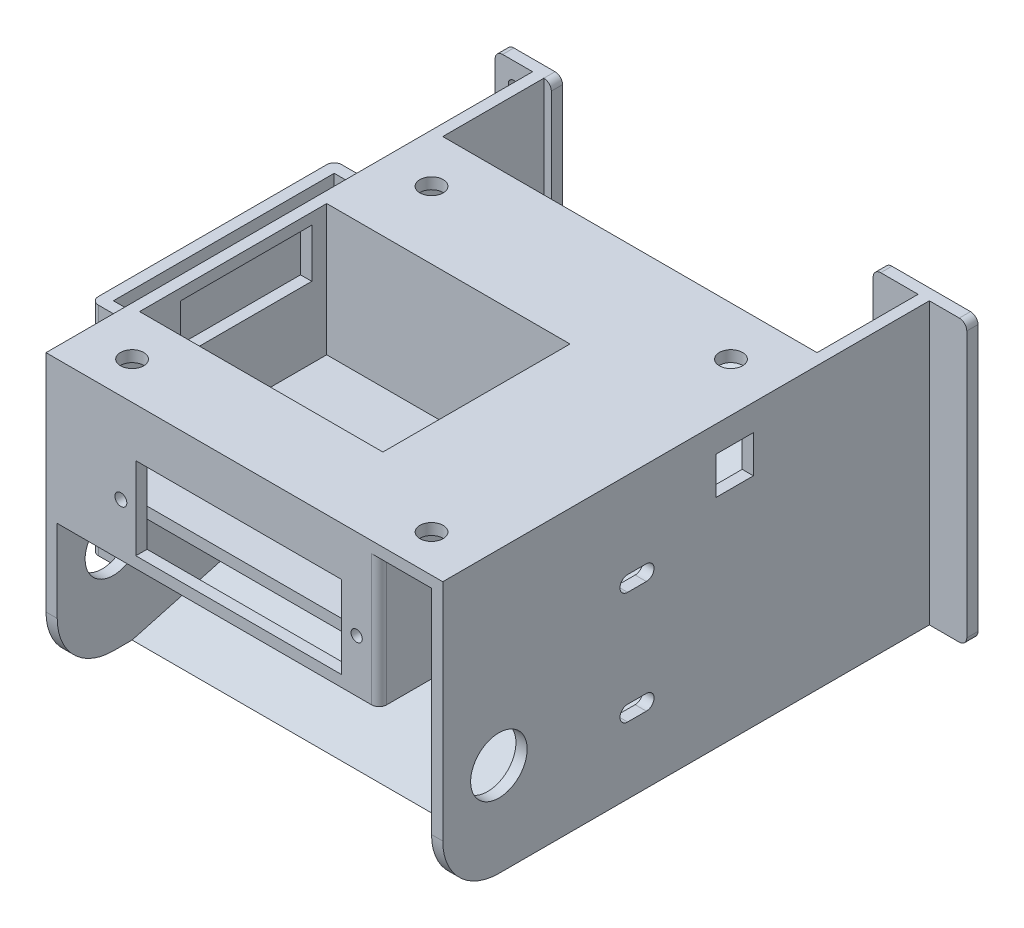
from build123d import *

# Parameters (mm, degrees)
SKETCH_1_W                      = 126
SKETCH_1_H                      = 75
EXTRUDE_1_DEPTH                 = 3
CUT_EXTRUDE_2_REACH             = 148.663
SKETCH_3_W                      = 86
SKETCH_3_H                      = 50
SKETCH_2_R                      = 1.5
CUT_EXTRUDE_1_DEPTH             = 147.662878739
SKETCH_4_W                      = 3
SKETCH_4_H                      = 75
EXTRUDE_2_DEPTH                 = 130
SKETCH_10_W                     = 100
SKETCH_10_H                     = 3
EXTRUDE_5_DEPTH                 = 100
CUT_EXTRUDE_5_REACH             = 199.965
SKETCH_9_R                      = 3.1
CUT_EXTRUDE_5_DIRECTION_2_DEPTH = 198.964643308
EXTRUDE_7_REACH                 = 191.955
CUT_EXTRUDE_9_DEPTH             = 190.95525789
CUT_EXTRUDE_9_DEPTH_BACK        = 190.95525789
SKETCH_18_R                     = 7.55
SKETCH_33_W                     = 65
SKETCH_33_H                     = 50
CUT_EXTRUDE_14_DEPTH            = 5
FILLET_1_R                      = 2
FILLET_2_R                      = 15
CUT_EXTRUDE_11_DEPTH            = 10
SKETCH_37_W                     = 89
SKETCH_37_H                     = 75
SKETCH_37_W_2                   = 83
SKETCH_37_H_2                   = 69
EXTRUDE_21_DEPTH                = 35
EXTRUDE_22_REACH                = 191.955
SKETCH_38_W                     = 59
SKETCH_38_H                     = 3
EXTRUDE_START                   = 5
EXTRUDE_23_DEPTH                = 75
SKETCH_43_W                     = 65
SKETCH_43_H                     = 58
EXTRUDE_24_DEPTH                = 23
SKETCH_44_W                     = 20
SKETCH_44_H                     = 59
CUT_EXTRUDE_15_DEPTH            = 55
SKETCH_48_W                     = 35
SKETCH_48_H                     = 13
CUT_EXTRUDE_16_DEPTH            = 12
SKETCH_49_W                     = 55
SKETCH_49_H                     = 22
CUT_EXTRUDE_18_DEPTH            = 12
SKETCH_50_R                     = 1.6
SKETCH_50_R_2                   = 1.5
CUT_EXTRUDE_19_DEPTH            = 12
CUT_EXTRUDE_21_REACH            = 201.887
SKETCH_52_W                     = 10
SKETCH_52_H                     = 10
FILLET_3_R                      = 2
SKETCH_53_W                     = 100
SKETCH_53_H                     = 3
EXTRUDE_25_DEPTH                = 3


with BuildPart() as part:
    # 草图1 → 凸台-拉伸1 (new body)
    with BuildSketch(Plane.XY):
        with Locations((63, 37.5)):
            Rectangle(SKETCH_1_W, SKETCH_1_H)
    extrude(amount=EXTRUDE_1_DEPTH)

    # 草图3 → 切除-拉伸2 (cut, up to next)
    with BuildSketch(Plane(origin=(0, 0, 0), x_dir=(-1, 0, 0), z_dir=(0, 0, -1)), mode=Mode.PRIVATE) as cut_extrude_2_sk1:
        with Locations((-58, 50)):
            Rectangle(SKETCH_3_W, SKETCH_3_H)
    cut_extrude_2_tool1 = extrude(cut_extrude_2_sk1.sketch, amount=-CUT_EXTRUDE_2_REACH, mode=Mode.PRIVATE) & part.part
    add(cut_extrude_2_tool1.solids().sort_by_distance((58, 50, 0))[0], mode=Mode.SUBTRACT)

    # 草图2 → 切除-拉伸1 (cut, through all)
    with BuildSketch(Plane.XY.offset(3)):
        with Locations((5, 69)):
            Circle(SKETCH_2_R)
        with Locations((5, 25)):
            Circle(SKETCH_2_R)
        with Locations((5, 9)):
            Circle(SKETCH_2_R)
        with Locations((111, 69)):
            Circle(SKETCH_2_R)
        with Locations((111, 9)):
            Circle(SKETCH_2_R)
    extrude(amount=-CUT_EXTRUDE_1_DEPTH, mode=Mode.SUBTRACT)

    # 草图4 → 凸台-拉伸2 (add)
    with BuildSketch(Plane.XY.offset(3)):
        with Locations((11.5, 37.5)):
            Rectangle(SKETCH_4_W, SKETCH_4_H)
    extrude_2 = extrude(amount=EXTRUDE_2_DEPTH)

    # 镜向1: 凸台-拉伸2 across plane
    add(extrude_2.mirror(Plane.ZY.offset(-63)))

    # 草图10 → 凸台-拉伸5 (add)
    with BuildSketch(Plane(origin=(13, 0, 0), x_dir=(0, 0, -1), z_dir=(1, 0, 0))):
        with Locations((-83, 73.5)):
            Rectangle(SKETCH_10_W, SKETCH_10_H)
    extrude(amount=EXTRUDE_5_DEPTH)

    # 草图9 → 切除-拉伸5 (cut, up to next)
    with BuildSketch(Plane(origin=(0, 75, 0), x_dir=(1, 0, 0), z_dir=(0, 1, 0)), mode=Mode.PRIVATE) as cut_extrude_5_sk1:
        with Locations(Location((23, -123, 0), (0, 0, 180))):
            Circle(SKETCH_9_R)
    cut_extrude_5_tool1 = extrude(cut_extrude_5_sk1.sketch, amount=-CUT_EXTRUDE_5_REACH, mode=Mode.PRIVATE) & part.part
    # 草图9 → 切除-拉伸5 (cut, up to next)
    with BuildSketch(Plane(origin=(0, 75, 0), x_dir=(1, 0, 0), z_dir=(0, 1, 0)), mode=Mode.PRIVATE) as cut_extrude_5_sk2:
        with Locations(Location((23, -43, 0), (0, 0, 180))):
            Circle(SKETCH_9_R)
    cut_extrude_5_tool2 = extrude(cut_extrude_5_sk2.sketch, amount=-CUT_EXTRUDE_5_REACH, mode=Mode.PRIVATE) & part.part
    # 草图9 → 切除-拉伸5 (cut, up to next)
    with BuildSketch(Plane(origin=(0, 75, 0), x_dir=(1, 0, 0), z_dir=(0, 1, 0)), mode=Mode.PRIVATE) as cut_extrude_5_sk3:
        with Locations(Location((103, -123, 0), (0, 0, 180))):
            Circle(SKETCH_9_R)
    cut_extrude_5_tool3 = extrude(cut_extrude_5_sk3.sketch, amount=-CUT_EXTRUDE_5_REACH, mode=Mode.PRIVATE) & part.part
    # 草图9 → 切除-拉伸5 (cut, up to next)
    with BuildSketch(Plane(origin=(0, 75, 0), x_dir=(1, 0, 0), z_dir=(0, 1, 0)), mode=Mode.PRIVATE) as cut_extrude_5_sk4:
        with Locations(Location((103, -43, 0), (0, 0, 180))):
            Circle(SKETCH_9_R)
    cut_extrude_5_tool4 = extrude(cut_extrude_5_sk4.sketch, amount=-CUT_EXTRUDE_5_REACH, mode=Mode.PRIVATE) & part.part
    add(cut_extrude_5_tool1.solids().sort_by_distance((23, 75, 123))[0], mode=Mode.SUBTRACT)
    add(cut_extrude_5_tool2.solids().sort_by_distance((23, 75, 43))[0], mode=Mode.SUBTRACT)
    add(cut_extrude_5_tool3.solids().sort_by_distance((103, 75, 123))[0], mode=Mode.SUBTRACT)
    add(cut_extrude_5_tool4.solids().sort_by_distance((103, 75, 43))[0], mode=Mode.SUBTRACT)

    # 草图9 → 切除-拉伸5 direction 2 (cut)
    with BuildSketch(Plane(origin=(0, 75, 0), x_dir=(1, 0, 0), z_dir=(0, 1, 0))):
        with Locations(Location((23, -123, 0), (0, 0, 180))):
            Circle(SKETCH_9_R)
        with Locations(Location((23, -43, 0), (0, 0, 180))):
            Circle(SKETCH_9_R)
        with Locations(Location((103, -123, 0), (0, 0, 180))):
            Circle(SKETCH_9_R)
        with Locations(Location((103, -43, 0), (0, 0, 180))):
            Circle(SKETCH_9_R)
    extrude(amount=CUT_EXTRUDE_5_DIRECTION_2_DEPTH, mode=Mode.SUBTRACT)

    # 凸台-拉伸7: up to this face of the body (flat: up to its plane)
    extrude_7_end = Plane(part.part.faces().sort_by_distance((113, 36.357142857, 67.523809524))[0])
    # 草图17 → 凸台-拉伸7 (add, up to the picked face)
    with BuildSketch(Plane(origin=(13, 0, 0), x_dir=(0, 0, -1), z_dir=(1, 0, 0)), mode=Mode.PRIVATE) as extrude_7_sk1:
        Polygon((-3, 0), (-113, 0), (-3, 30), align=None)
    extrude_7_tool1 = split(extrude(extrude_7_sk1.sketch, amount=EXTRUDE_7_REACH, mode=Mode.PRIVATE), bisect_by=extrude_7_end, keep=Keep.BOTH, mode=Mode.PRIVATE)
    add(extrude_7_tool1.solids().sort_by(Axis((13, 10, 39.666667), (1, 0, 0)))[0])

    # 草图18 → 切除-拉伸9 (cut, two sides: drawn at the far end of the back side and taken through both)
    with BuildSketch(Plane(origin=(13, 0, 0), x_dir=(0, 0, -1), z_dir=(1, 0, 0)).offset(-CUT_EXTRUDE_9_DEPTH_BACK)):
        with Locations(Location((-118, 25, 0), (0, 0, 90))):
            Circle(SKETCH_18_R)
    extrude(amount=CUT_EXTRUDE_9_DEPTH + CUT_EXTRUDE_9_DEPTH_BACK, mode=Mode.SUBTRACT)

    # 草图33 → 切除-拉伸14 (cut)
    with BuildSketch(Plane(origin=(0, 75, 0), x_dir=(1, 0, 0), z_dir=(0, 1, 0))):
        with Locations((45.5, -86)):
            Rectangle(SKETCH_33_W, SKETCH_33_H)
    extrude(amount=-CUT_EXTRUDE_14_DEPTH, mode=Mode.SUBTRACT)

    # 圆角1
    fillet_1_edges = [part.edges().sort_by_distance(p)[0] for p in [
        (101, 75, 1.5),
        (15, 75, 1.5),
        (0, 0, 1.5),
        (0, 75, 1.5),
        (126, 75, 1.5),
        (126, 0, 1.5),
    ]]
    fillet(fillet_1_edges, radius=FILLET_1_R)

    # 圆角2
    fillet_2_edges = [part.edges().sort_by_distance(p)[0] for p in [
        (11.5, 0, 133),
        (114.5, 0, 133),
    ]]
    fillet(fillet_2_edges, radius=FILLET_2_R)

    # 草图20 → 切除-拉伸11 (cut)
    with BuildSketch(Plane(origin=(116, 0, 0), x_dir=(0, 0, -1), z_dir=(1, 0, 0))):
        with BuildLine():
            Line((-83.606081957, 51.95), (-78.606081957, 51.95))
            ThreePointArc((-78.606081957, 51.95), (-76.556081957, 49.9), (-78.606081957, 47.85))
            Line((-78.606081957, 47.85), (-83.606081957, 47.85))
            ThreePointArc((-83.606081957, 47.85), (-85.656081957, 49.9), (-83.606081957, 51.95))
        make_face()
        with BuildLine():
            Line((-83.606081957, 21.95), (-78.606081957, 21.95))
            ThreePointArc((-78.606081957, 21.95), (-76.556081957, 19.9), (-78.606081957, 17.85))
            Line((-78.606081957, 17.85), (-83.606081957, 17.85))
            ThreePointArc((-83.606081957, 17.85), (-85.656081957, 19.9), (-83.606081957, 21.95))
        make_face()
    extrude(amount=-CUT_EXTRUDE_11_DEPTH, mode=Mode.SUBTRACT)

    # 草图37 → 凸台-拉伸21 (add)
    with BuildSketch(Plane.XZ.offset(-72)):
        with Locations((54.5, 95.5)):
            Rectangle(SKETCH_37_W, SKETCH_37_H)
        with Locations((54.5, 95.5)):
            Rectangle(SKETCH_37_W_2, SKETCH_37_H_2, mode=Mode.SUBTRACT)
    extrude(amount=EXTRUDE_21_DEPTH)

    # 草图38 → 凸台-拉伸22 (add, up to next)
    with BuildSketch(Plane(origin=(13, 0, 0), x_dir=(0, 0, -1), z_dir=(1, 0, 0)), mode=Mode.PRIVATE) as extrude_22_sk1:
        with Locations((-90.5, 38.5)):
            Rectangle(SKETCH_38_W, SKETCH_38_H)
    extrude_22_tool1 = extrude(extrude_22_sk1.sketch, amount=EXTRUDE_22_REACH, mode=Mode.PRIVATE) - part.part
    add(extrude_22_tool1.solids().sort_by_distance((13, 38.5, 90.5))[0])

    # 草图41 → 凸台-拉伸23 (add)
    with BuildSketch(Plane(origin=(15, 0, 0), x_dir=(0, 0, -1), z_dir=(1, 0, 0)).offset(EXTRUDE_START)):
        Polygon((-3, 25), (-3, 30), (3, 35), (3, 25), align=None)
    extrude(amount=EXTRUDE_23_DEPTH)

    # 草图43 → 凸台-拉伸24 (add)
    with BuildSketch(Plane.ZY.offset(-10)):
        with Locations((65.5, 29)):
            Rectangle(SKETCH_43_W, SKETCH_43_H)
    extrude(amount=EXTRUDE_24_DEPTH)

    # 草图44 → 切除-拉伸15 (cut)
    with BuildSketch(Plane(origin=(0, 58, 0), x_dir=(1, 0, 0), z_dir=(0, 1, 0))):
        with Locations((0, -65.5)):
            Rectangle(SKETCH_44_W, SKETCH_44_H)
    extrude(amount=-CUT_EXTRUDE_15_DEPTH, mode=Mode.SUBTRACT)

    # 草图48 → 切除-拉伸16 (cut)
    with BuildSketch(Plane.ZY.offset(-10)):
        with Locations((82.5, 65.5)):
            Rectangle(SKETCH_48_W, SKETCH_48_H)
    extrude(amount=-CUT_EXTRUDE_16_DEPTH, mode=Mode.SUBTRACT)

    # 草图49 → 切除-拉伸18 (cut)
    with BuildSketch(Plane.XY.offset(133)):
        with Locations((61.5, 51)):
            Rectangle(SKETCH_49_W, SKETCH_49_H)
    extrude(amount=-CUT_EXTRUDE_18_DEPTH, mode=Mode.SUBTRACT)

    # 草图50 → 切除-拉伸19 (cut)
    with BuildSketch(Plane.XY.offset(133)):
        with Locations((30, 51)):
            Circle(SKETCH_50_R)
        with Locations((93, 51)):
            Circle(SKETCH_50_R_2)
    extrude(amount=-CUT_EXTRUDE_19_DEPTH, mode=Mode.SUBTRACT)

    # 草图52 → 切除-拉伸21 (cut, up to next)
    with BuildSketch(Plane(origin=(116, 0, 0), x_dir=(0, 0, -1), z_dir=(1, 0, 0)), mode=Mode.PRIVATE) as cut_extrude_21_sk1:
        with Locations((-55, 63)):
            Rectangle(SKETCH_52_W, SKETCH_52_H)
    cut_extrude_21_tool1 = extrude(cut_extrude_21_sk1.sketch, amount=-CUT_EXTRUDE_21_REACH, mode=Mode.PRIVATE) & part.part
    add(cut_extrude_21_tool1.solids().sort_by_distance((116, 63, 55))[0], mode=Mode.SUBTRACT)

    # 圆角3
    fillet_3_edges = [part.edges().sort_by_distance(p)[0] for p in [
        (99, 54.5, 133),
        (99, 54.5, 58),
        (-13, 29, 33),
        (-13, 29, 98),
    ]]
    fillet(fillet_3_edges, radius=FILLET_3_R)

    # 草图53 → 凸台-拉伸25 (add)
    with BuildSketch(Plane(origin=(0, 0, 33), x_dir=(-1, 0, 0), z_dir=(0, 0, -1))):
        with Locations((-63, 73.5)):
            Rectangle(SKETCH_53_W, SKETCH_53_H)
    extrude(amount=EXTRUDE_25_DEPTH)


solid = part.part
